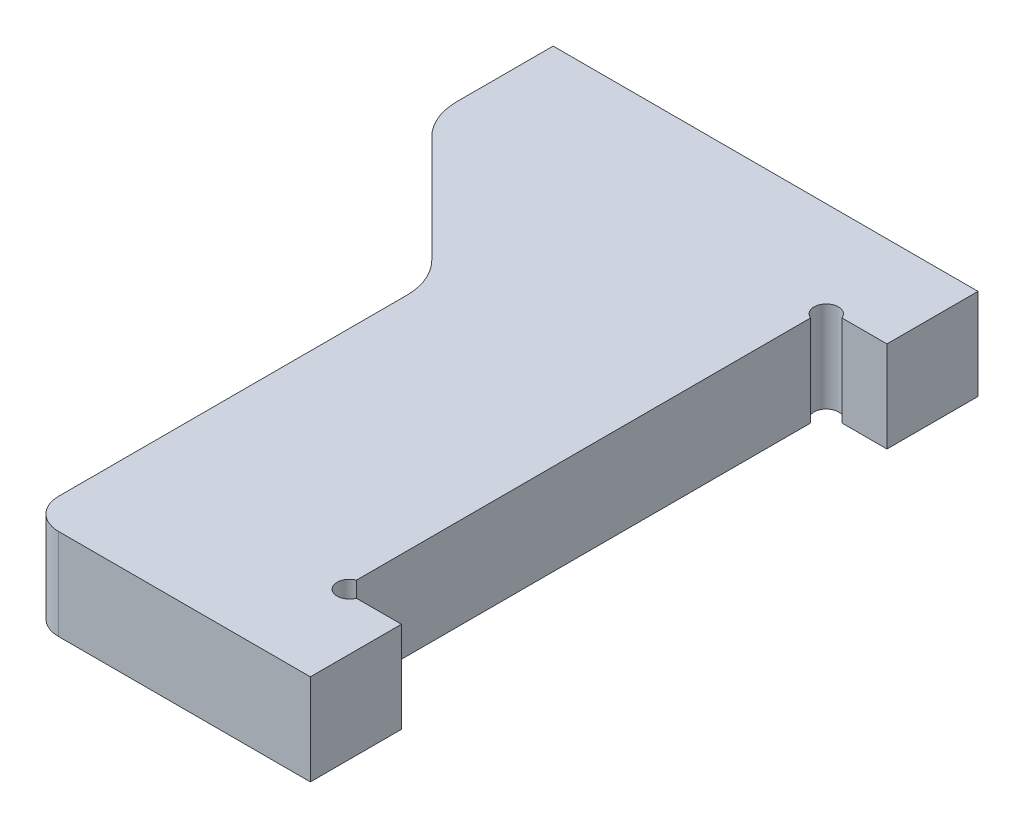
from build123d import *

# Parameters (mm, degrees)
SKETCH1_W           = 36.5
SKETCH1_H           = 110
BOSS_EXTRUDE1_DEPTH = 15
BOSS_EXTRUDE2_DEPTH = 15
FILLET1_R           = 10
FILLET2_R           = 5
SKETCH3_W           = 10
SKETCH3_H           = 15
BOSS_EXTRUDE3_DEPTH = 15
SKETCH4_R           = 2
CUT_EXTRUDE1_DEPTH  = 71.661605558


with BuildPart() as part:
    # Sketch1 → Boss-Extrude1 (new body)
    with BuildSketch(Plane(origin=(0, 0, 0), x_dir=(1, 0, 0), z_dir=(0, 1, 0))):
        Rectangle(SKETCH1_W, SKETCH1_H)
    extrude(amount=BOSS_EXTRUDE1_DEPTH)

    # Sketch2 → Boss-Extrude2 (add)
    with BuildSketch(Plane(origin=(0, 15, 0), x_dir=(1, 0, 0), z_dir=(0, 1, 0))):
        Polygon((-18.25, 11.5), (-41.75, 35), (-41.75, 55), (-18.25, 55), align=None)
    extrude(amount=-BOSS_EXTRUDE2_DEPTH)

    # Fillet1
    fillet1_edges = [part.edges().sort_by_distance(p)[0] for p in [
        (-18.25, 7.5, -11.5),
        (-41.75, 7.5, -35),
    ]]
    fillet(fillet1_edges, radius=FILLET1_R)

    # Fillet2
    fillet2_edges = [part.edges().sort_by_distance(p)[0] for p in [
        (-18.25, 7.5, 55),
    ]]
    fillet(fillet2_edges, radius=FILLET2_R)

    # Sketch3 → Boss-Extrude3 (add)
    with BuildSketch(Plane(origin=(0, 15, 0), x_dir=(1, 0, 0), z_dir=(0, 1, 0))):
        with Locations((23.25, -47.5)):
            Rectangle(SKETCH3_W, SKETCH3_H)
        with Locations((23.25, 47.5)):
            Rectangle(SKETCH3_W, SKETCH3_H)
    extrude(amount=-BOSS_EXTRUDE3_DEPTH)

    # Sketch4 → Cut-Extrude1 (cut, through all)
    with BuildSketch(Plane(origin=(0, 15, 0), x_dir=(1, 0, 0), z_dir=(0, 1, 0))):
        with Locations((18.957106781, 39.292893219)):
            Circle(SKETCH4_R)
        with Locations((18.957106781, -39.292893219)):
            Circle(SKETCH4_R)
    extrude(amount=-CUT_EXTRUDE1_DEPTH, mode=Mode.SUBTRACT)


solid = part.part
